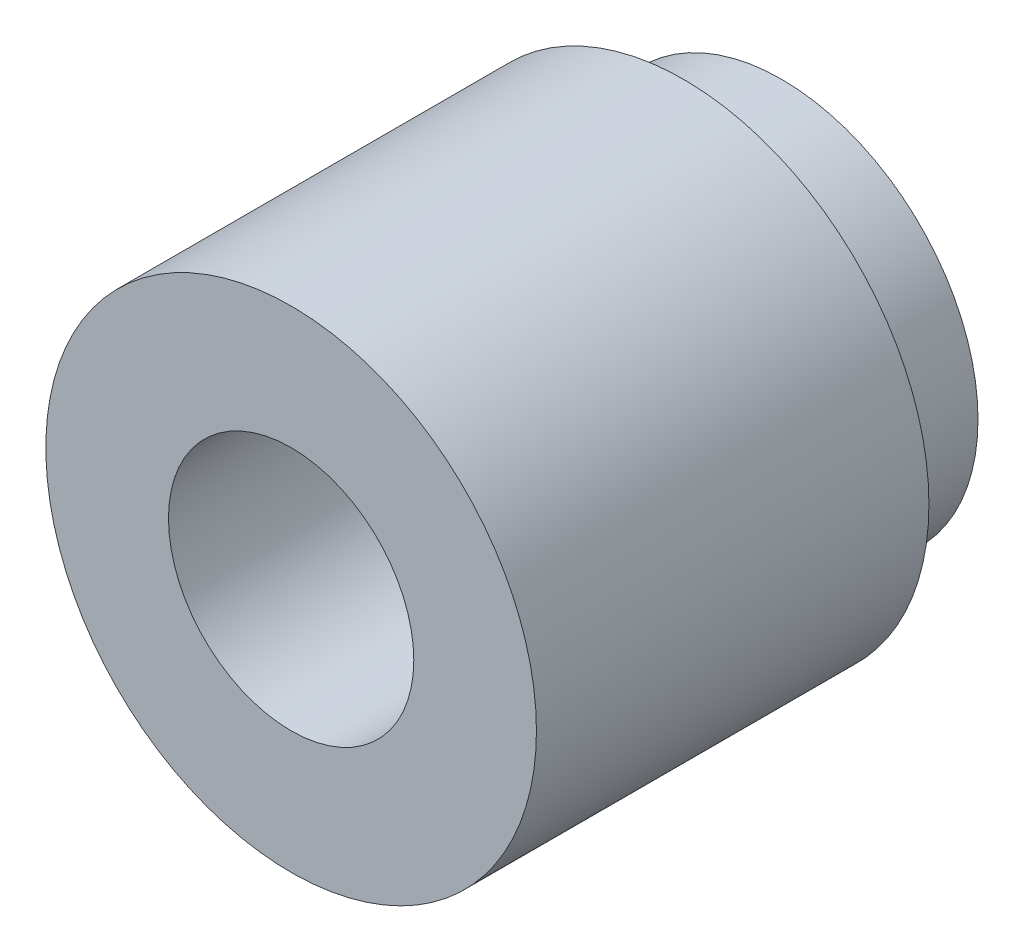
from build123d import *
from build123d.topology import SkipClean

# Parameters (mm, degrees)
SKETCH_1_R      = 2.5
SKETCH_1_R_2    = 1.25
EXTRUDE_1_DEPTH = 4
EXTRUDE_START   = 1
SKETCH_2_R      = 2
SKETCH_2_R_2    = 1.25
EXTRUDE_2_DEPTH = 1


with BuildPart() as part:
    # 草图1 → 凸台-拉伸1 (new body)
    with BuildSketch(Plane.XY):
        Circle(SKETCH_1_R)
        Circle(SKETCH_1_R_2, mode=Mode.SUBTRACT)
    extrude(amount=EXTRUDE_1_DEPTH)

    # 草图2 → 凸台-拉伸2 (add)
    with SkipClean():  # the faces are left unmerged after this step: merging them gives an invalid solid
        with BuildSketch(Plane(origin=(0, 0, 0), x_dir=(-1, 0, 0), z_dir=(0, 0, -1)).offset(EXTRUDE_START)):
            with Locations(Location((0, 0, 0), (0, 0, 180))):
                Circle(SKETCH_2_R)
            Circle(SKETCH_2_R_2, mode=Mode.SUBTRACT)
        extrude(amount=-EXTRUDE_2_DEPTH)


solid = part.part
